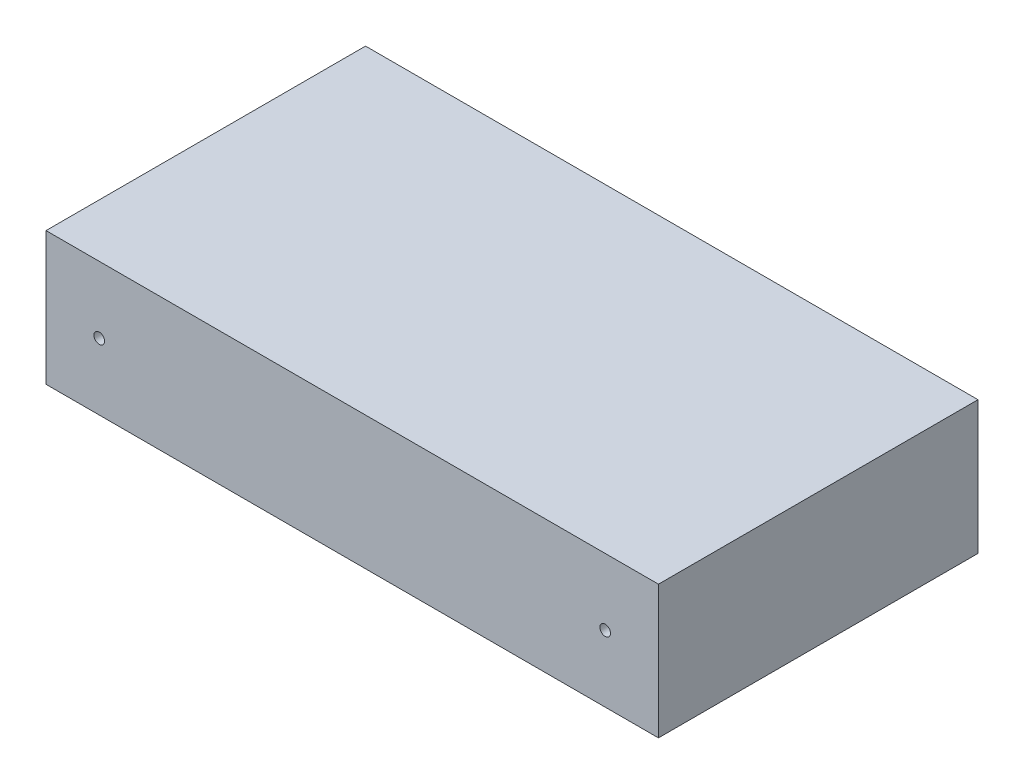
from build123d import *

# Parameters (mm, degrees)
SKETCH1_W           = 230
SKETCH1_H           = 120
BOSS_EXTRUDE1_DEPTH = 50
SKETCH2_R           = 2
CUT_EXTRUDE1_DEPTH  = 10


with BuildPart() as part:
    # Sketch1 → Boss-Extrude1 (new body)
    with BuildSketch(Plane(origin=(0, 0, 0), x_dir=(1, 0, 0), z_dir=(0, 1, 0))):
        with Locations((115, 60)):
            Rectangle(SKETCH1_W, SKETCH1_H)
    extrude(amount=BOSS_EXTRUDE1_DEPTH)

    # Sketch2 → Cut-Extrude1 (cut)
    with BuildSketch(Plane.XY):
        with Locations((20, 25)):
            Circle(SKETCH2_R)
        with Locations((210, 25)):
            Circle(SKETCH2_R)
    extrude(amount=-CUT_EXTRUDE1_DEPTH, mode=Mode.SUBTRACT)


solid = part.part
